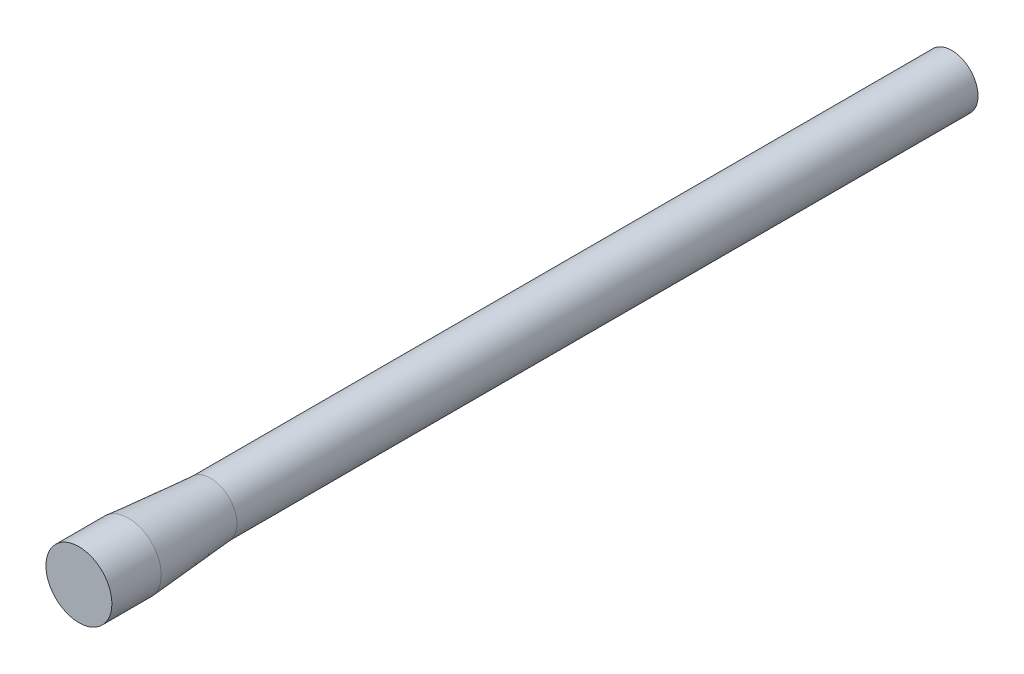
from build123d import *

# Parameters (mm, degrees)
SCHIZZO1_R                   = 1.6
ESTRUSIONE_ESTRUSIONE1_DEPTH = 45
SCHIZZO2_R                   = 1.6
ESTRUSIONE_ESTRUSIONE2_DEPTH = 5
ESTRUSIONE_ESTRUSIONE2_DRAFT = -4.6
SCHIZZO3_R                   = 2.002290448
ESTRUSIONE_ESTRUSIONE3_DEPTH = 3


with BuildPart() as part:
    # Schizzo1 → Estrusione-Estrusione1 (new body)
    with BuildSketch(Plane(origin=(0, 0, 0), x_dir=(0, 1, 0), z_dir=(0, 0, 1))):
        with Locations(Location((0, 0, 0), (0, 0, 90))):
            Circle(SCHIZZO1_R)
    extrude(amount=ESTRUSIONE_ESTRUSIONE1_DEPTH)


with BuildPart() as estrusione_estrusione2_tool:
    # Schizzo2 → Estrusione-Estrusione2 (with draft: the straight prism first)
    with BuildSketch(Plane.XY.offset(45)):
        with Locations(Location((0, 0, 0), (0, 0, 180))):
            Circle(SCHIZZO2_R)
    extrude(amount=ESTRUSIONE_ESTRUSIONE2_DEPTH)
    # Estrusione-Estrusione2: the draft: its side faces are tilted about the plane it starts from
    estrusione_estrusione2_sides = [estrusione_estrusione2_tool.faces().sort_by_distance(p)[0] for p in [
        (1.6, 0, 47.5),
    ]]
    draft(estrusione_estrusione2_sides, Plane.XY.offset(45), ESTRUSIONE_ESTRUSIONE2_DRAFT)


with BuildPart() as part_1:
    add(part.part)

    # Estrusione-Estrusione2: add estrusione_estrusione2_tool
    add(estrusione_estrusione2_tool.part)

    # Schizzo3 → Estrusione-Estrusione3 (add)
    with BuildSketch(Plane.XY.offset(50)):
        Circle(SCHIZZO3_R)
    extrude(amount=ESTRUSIONE_ESTRUSIONE3_DEPTH)


solid = part_1.part
